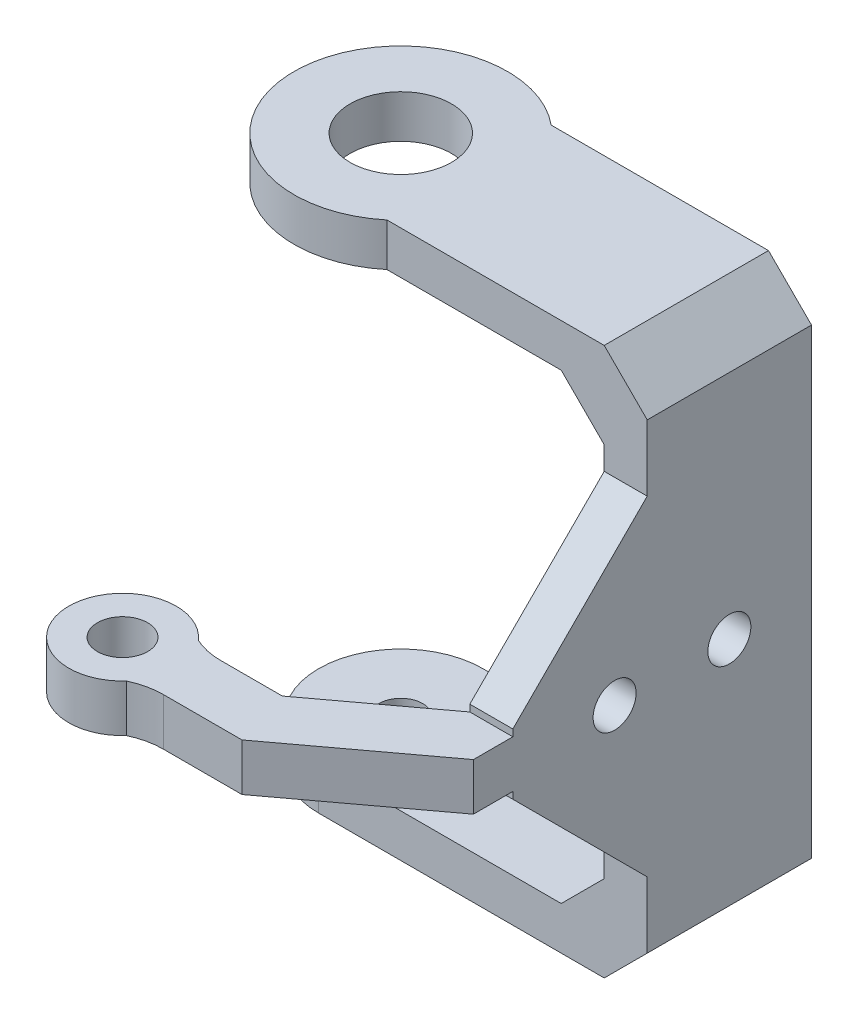
from build123d import *

# Parameters (mm, degrees)
BOSS_EXTRUDE1_DEPTH      = 5.73
BOSS_EXTRUDE1_DEPTH_BACK = 5.73
BOSS_EXTRUDE2_DEPTH      = 11.46
BOSS_EXTRUDE3_DEPTH      = 11.46
BOSS_EXTRUDE4_DEPTH      = 2.999321
SKETCH7_R                = 3.54
CUT_EXTRUDE2_DEPTH       = 2.999322
BOSS_EXTRUDE5_DEPTH      = 3
SKETCH11_R               = 1.52
CUT_EXTRUDE3_DEPTH       = 3
BOSS_EXTRUDE6_DEPTH      = 3.000001
BOSS_EXTRUDE7_DEPTH      = 1.65
BOSS_EXTRUDE7_DEPTH_BACK = 1.65
SKETCH16_R               = 1.75
CUT_EXTRUDE4_DEPTH       = 3.3
CUT_EXTRUDE5_START       = -3.000002
SKETCH17_R               = 1.5
CUT_EXTRUDE5_DEPTH       = 3.000002


with BuildPart() as part:
    # Sketch1 → Boss-Extrude1 (new, two sides: drawn at the far end of the back side and taken through both)
    with BuildSketch(Plane.XY.offset(-BOSS_EXTRUDE1_DEPTH_BACK)):
        Polygon((32.166139185, 36.798009468), (35.166138746, 39.798007166), (38.166139237, 36.798004811), (38.166139237, 4.578006273), (35.166137814, 1.578006712), (32.166137322, 4.578009067), (35.166137814, 7.578007696), (35.166137814, 33.798008976), align=None)
    extrude(amount=BOSS_EXTRUDE1_DEPTH + BOSS_EXTRUDE1_DEPTH_BACK)

    # Sketch2 → Boss-Extrude2 (add)
    with BuildSketch(Plane.XY.offset(5.73)):
        Polygon((32.166139185, 36.798009468), (20.006139185, 36.798009468), (20.006139185, 39.797331447), (32.166139185, 39.797331447), (35.165463026, 39.797331447), align=None)
    extrude(amount=-BOSS_EXTRUDE2_DEPTH)

    # Sketch3 → Boss-Extrude3 (add)
    with BuildSketch(Plane.XY.offset(5.73)):
        Polygon((32.166137322, 4.578009067), (35.166137814, 1.578006712), (32.166137322, 1.578006712), (20.006137322, 1.578006712), (20.006137322, 4.578009067), align=None)
    extrude(amount=-BOSS_EXTRUDE3_DEPTH)

    # Sketch4 → Boss-Extrude4 (add)
    with BuildSketch(Plane(origin=(0, 39.797331447, 0), x_dir=(1, 0, 0), z_dir=(0, 1, 0))):
        with BuildLine():
            Line((20.006139185, 5.73), (20.006139185, -5.73))
            ThreePointArc((20.006139185, -5.73), (7.794878848, 0), (20.006139185, 5.73))
        make_face()
    extrude(amount=-BOSS_EXTRUDE4_DEPTH)

    # Sketch7 → Cut-Extrude2 (cut)
    with BuildSketch(Plane(origin=(0, 39.797331447, 0), x_dir=(1, 0, 0), z_dir=(0, 1, 0))):
        with Locations(Location((15.244878848, 0, 0), (0, 0, 270))):
            Circle(SKETCH7_R)
    extrude(amount=-CUT_EXTRUDE2_DEPTH, mode=Mode.SUBTRACT)

    # Sketch9 → Boss-Extrude5 (add)
    with BuildSketch(Plane(origin=(0, 1.578006712, 0), x_dir=(-1, 0, 0), z_dir=(0, -1, 0))):
        with BuildLine():
            Line((-20.006139185, -5.73), (-15.244878848, -5.73))
            ThreePointArc((-15.244878848, -5.73), (-9.514878848, 0), (-15.244878848, 5.73))
            Line((-15.244878848, 5.73), (-20.006137322, 5.73))
            Line((-20.006137322, 5.73), (-20.006139185, -5.73))
        make_face()
    extrude(amount=-BOSS_EXTRUDE5_DEPTH)

    # Sketch11 → Cut-Extrude3 (cut)
    with BuildSketch(Plane(origin=(0, 1.578006712, 0), x_dir=(-1, 0, 0), z_dir=(0, -1, 0))):
        with Locations(Location((-15.244878848, 0, 0), (0, 0, 90))):
            Circle(SKETCH11_R)
    extrude(amount=-CUT_EXTRUDE3_DEPTH, mode=Mode.SUBTRACT)

    # Sketch12 → Boss-Extrude6 (add)
    with BuildSketch(Plane(origin=(38.166139237, 0, 0), x_dir=(0, 0, -1), z_dir=(1, 0, 0))):
        Polygon((-5.73, 32.188009468), (-5.73, 9.188006273), (-15.106235919, 18.564242191), (-15.106235919, 22.811773549), align=None)
    extrude(amount=-BOSS_EXTRUDE6_DEPTH)

    # Sketch15 → Boss-Extrude7 (add, two sides: drawn at the far end of the back side and taken through both)
    with BuildSketch(Plane(origin=(0, 20.688006712, 0), x_dir=(-1, 0, 0), z_dir=(0, -1, 0)).offset(-BOSS_EXTRUDE7_DEPTH_BACK)):
        with BuildLine():
            Line((-35.166137814, -15.106235919), (-38.166139237, -15.106235919))
            Line((-38.166139237, -15.106235919), (-38.166139237, -17.856235919))
            Line((-38.166139237, -17.856235919), (-28.905229431, -24.74152092))
            Line((-28.905229431, -24.74152092), (-23.425229431, -24.74152092))
            ThreePointArc((-23.425229431, -24.74152092), (-22.34653106, -24.859266336), (-21.318637405, -25.20695699))
            ThreePointArc((-21.318637405, -25.20695699), (-14.780458687, -22.662554763), (-21.367447992, -20.247324851))
            ThreePointArc((-21.367447992, -20.247324851), (-22.331583152, -20.573202418), (-23.34330167, -20.683558368))
            Line((-23.34330167, -20.683558368), (-27.661740817, -20.683558368))
            Line((-27.661740817, -20.683558368), (-35.166137814, -15.106235919))
        make_face()
    extrude(amount=BOSS_EXTRUDE7_DEPTH + BOSS_EXTRUDE7_DEPTH_BACK)

    # Sketch16 → Cut-Extrude4 (cut)
    with BuildSketch(Plane(origin=(0, 19.038006712, 0), x_dir=(-1, 0, 0), z_dir=(0, -1, 0))):
        with Locations(Location((-18.530277094, -22.699458879, 0), (0, 0, 90))):
            Circle(SKETCH16_R)
    extrude(amount=-CUT_EXTRUDE4_DEPTH, mode=Mode.SUBTRACT)

    # Sketch17 → Cut-Extrude5 (cut)
    with BuildSketch(Plane(origin=(38.166139237, 0, 0), x_dir=(0, 0, -1), z_dir=(1, 0, 0)).offset(CUT_EXTRUDE5_START)):
        with Locations(Location((-8.006235919, 20.688005542, 0), (0, 0, 90))):
            Circle(SKETCH17_R)
        with Locations(Location((0, 20.688005542, 0), (0, 0, 90))):
            Circle(SKETCH17_R)
    extrude(amount=CUT_EXTRUDE5_DEPTH, mode=Mode.SUBTRACT)


solid = part.part
